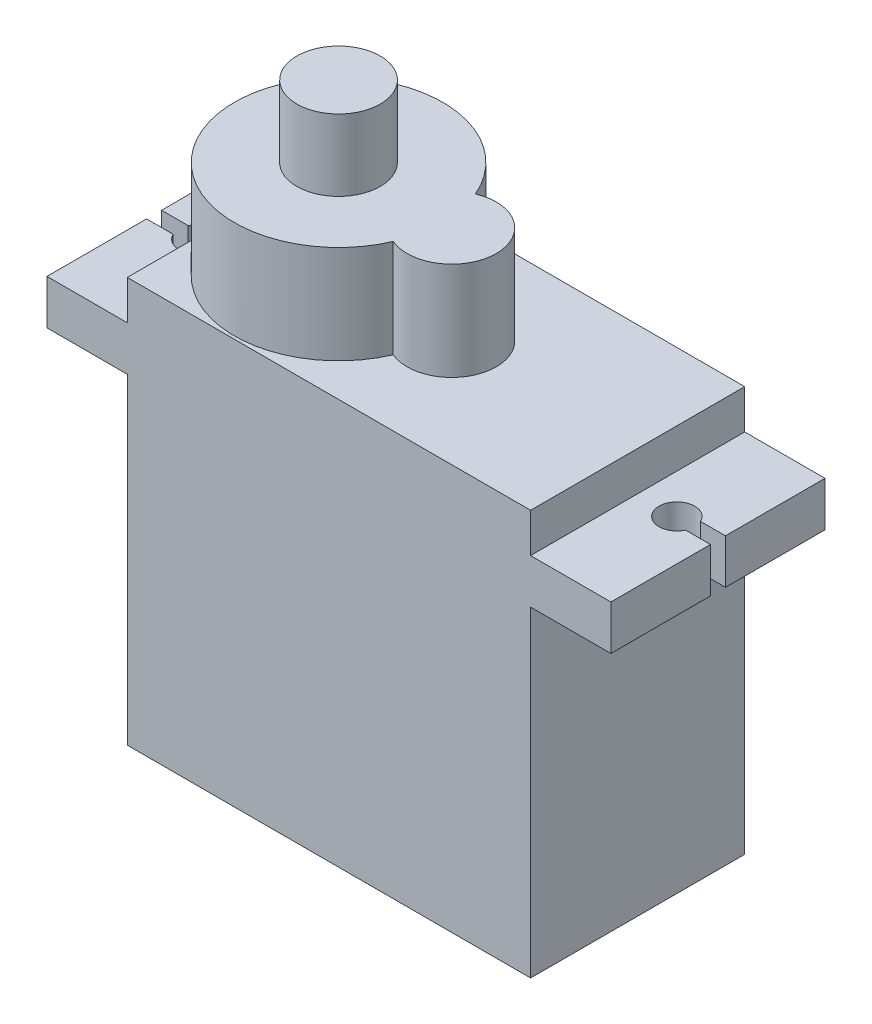
from build123d import *

# Parameters (mm, degrees)
SKETCH1_W            = 22.6
SKETCH1_H            = 12
BOSS_EXTRUDE1_DEPTH  = 22.7
SKETCH4_R            = 5.84
BOSS_EXTRUDE6_DEPTH  = 5.5
SKETCH12_R           = 2.335
BOSS_EXTRUDE7_DEPTH  = 4
SKETCH13_R           = 2.5
BOSS_EXTRUDE8_DEPTH  = 5.5
SKETCH14_W           = 12
SKETCH14_H           = 2.5
BOSS_EXTRUDE10_DEPTH = 4.5
SKETCH15_R           = 1
SKETCH15_W           = 1.5
SKETCH15_H           = 0.84
CUT_EXTRUDE3_DEPTH   = 52.05819482
SKETCH16_W           = 12
SKETCH16_H           = 2.5
BOSS_EXTRUDE11_DEPTH = 4.5
SKETCH17_R           = 1
SKETCH17_W           = 1.5
SKETCH17_H           = 0.84
CUT_EXTRUDE4_DEPTH   = 56.162931847


with BuildPart() as part:
    # Sketch1 → Boss-Extrude1 (new body)
    with BuildSketch(Plane(origin=(0, 0, 0), x_dir=(1, 0, 0), z_dir=(0, 1, 0))):
        with Locations((-34.895532414, -1.256861806)):
            Rectangle(SKETCH1_W, SKETCH1_H)
    extrude(amount=BOSS_EXTRUDE1_DEPTH)

    # Sketch4 → Boss-Extrude6 (add)
    with BuildSketch(Plane(origin=(0, 22.7, 0), x_dir=(-1, 0, 0), z_dir=(0, 1, 0))):
        with Locations((40.355532414, 1.256861806)):
            Circle(SKETCH4_R)
    extrude(amount=BOSS_EXTRUDE6_DEPTH)

    # Sketch12 → Boss-Extrude7 (add)
    with BuildSketch(Plane(origin=(0, 28.2, 0), x_dir=(-1, 0, 0), z_dir=(0, 1, 0))):
        with Locations(Location((40.355532414, 1.256861806, 0), (0, 0, 90))):
            Circle(SKETCH12_R)
    extrude(amount=BOSS_EXTRUDE7_DEPTH)

    # Sketch13 → Boss-Extrude8 (add)
    with BuildSketch(Plane(origin=(0, 22.7, 0), x_dir=(-1, 0, 0), z_dir=(0, 1, 0))):
        with Locations((34.015532414, 1.256861806)):
            Circle(SKETCH13_R)
    extrude(amount=BOSS_EXTRUDE8_DEPTH)

    # Sketch14 → Boss-Extrude10 (add)
    with BuildSketch(Plane(origin=(-23.595532414, 0, 0), x_dir=(0, 0, -1), z_dir=(1, 0, 0))):
        with Locations((-1.256861806, 19.25)):
            Rectangle(SKETCH14_W, SKETCH14_H)
    extrude(amount=BOSS_EXTRUDE10_DEPTH)

    # Sketch15 → Cut-Extrude3 (cut, through all)
    with BuildSketch(Plane(origin=(0, 20.5, 0), x_dir=(-1, 0, 0), z_dir=(0, 1, 0))):
        with Locations((21.395532414, 1.256861806)):
            Circle(SKETCH15_R)
        with Locations((48.395532414, 1.256861806)):
            Circle(SKETCH15_R)
        with Locations((19.845532414, 1.256861806)):
            Rectangle(SKETCH15_W, SKETCH15_H)
    extrude(amount=-CUT_EXTRUDE3_DEPTH, mode=Mode.SUBTRACT)

    # Sketch16 → Boss-Extrude11 (add)
    with BuildSketch(Plane.ZY.offset(46.195532414)):
        with Locations((1.256861806, 19.25)):
            Rectangle(SKETCH16_W, SKETCH16_H)
    extrude(amount=BOSS_EXTRUDE11_DEPTH)

    # Sketch17 → Cut-Extrude4 (cut, through all)
    with BuildSketch(Plane(origin=(0, 20.5, 0), x_dir=(-1, 0, 0), z_dir=(0, 1, 0))):
        with Locations((48.295532414, 1.256861806)):
            Circle(SKETCH17_R)
        with Locations((49.945532414, 1.256861806)):
            Rectangle(SKETCH17_W, SKETCH17_H)
    extrude(amount=-CUT_EXTRUDE4_DEPTH, mode=Mode.SUBTRACT)


solid = part.part
